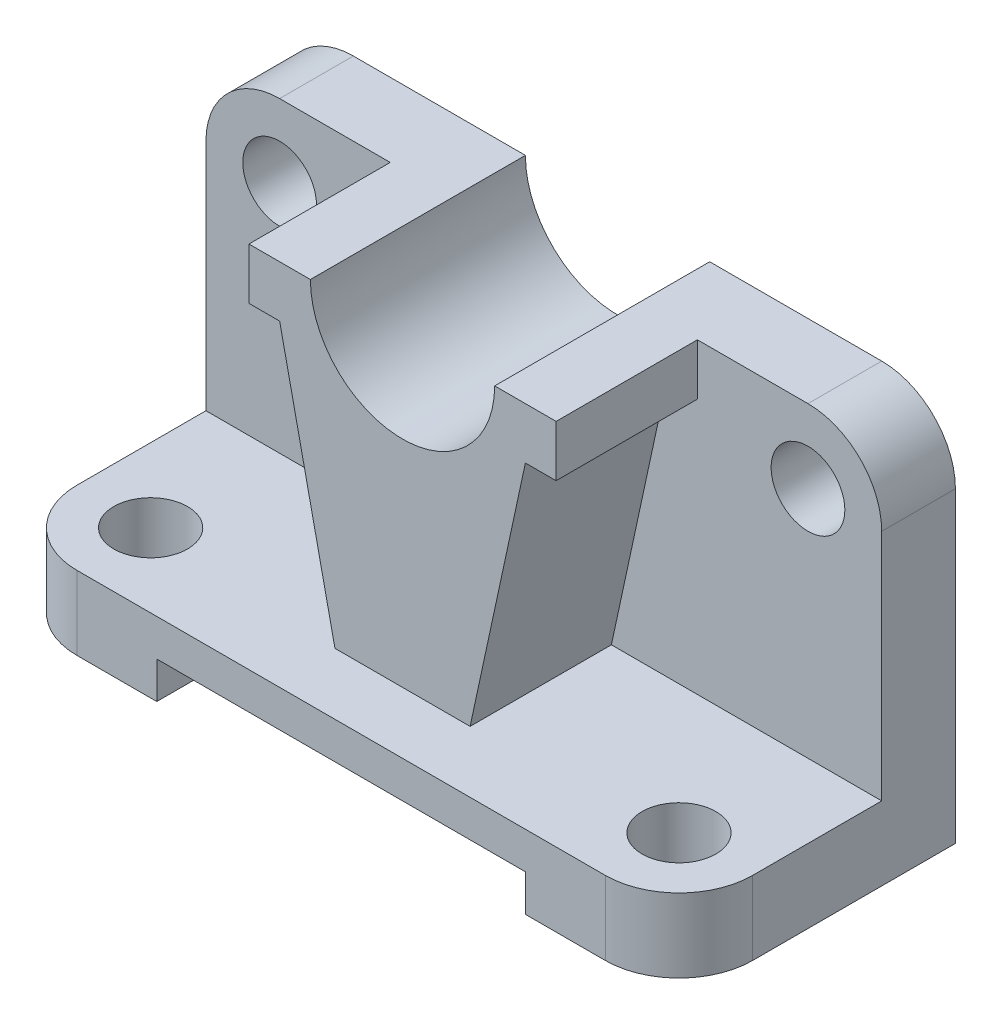
from build123d import *

# Parameters (mm, degrees)
SKETCH1_W           = 110
SKETCH1_H           = 62
BOSS_EXTRUDE1_DEPTH = 12
SKETCH2_W           = 110
SKETCH2_H           = 12
BOSS_EXTRUDE2_DEPTH = 33
BOSS_EXTRUDE3_DEPTH = 23
SKETCH7_R           = 6
CUT_EXTRUDE8_DEPTH  = 131.510535973
SKETCH9_R           = 6
CUT_EXTRUDE9_DEPTH  = 131.510535973
SKETCH10_R          = 6
CUT_EXTRUDE10_DEPTH = 129.937969582
SKETCH11_R          = 6
CUT_EXTRUDE11_DEPTH = 129.937969582
SKETCH15_W          = 60
SKETCH15_H          = 6
CUT_EXTRUDE15_DEPTH = 135.048498686
FILLET3_R           = 12
SKETCH16_R          = 15
CUT_EXTRUDE16_DEPTH = 132.030530793


with BuildPart() as part:
    # Sketch1 → Boss-Extrude1 (new body)
    with BuildSketch(Plane.XY):
        with Locations((55, 31)):
            Rectangle(SKETCH1_W, SKETCH1_H)
    extrude(amount=BOSS_EXTRUDE1_DEPTH)

    # Sketch2 → Boss-Extrude2 (add)
    with BuildSketch(Plane.XY.offset(12)):
        with Locations((55, 6)):
            Rectangle(SKETCH2_W, SKETCH2_H)
    extrude(amount=BOSS_EXTRUDE2_DEPTH)

    # Sketch3 → Boss-Extrude3 (add)
    with BuildSketch(Plane.XY.offset(12)):
        Polygon((75, 53.634363687), (35, 53.634363687), (44, 12), (66, 12), align=None)
        Polygon((80, 62), (30, 62), (30, 53.634363687), (35, 53.634363687), (75, 53.634363687), (80, 53.634363687), align=None)
    extrude(amount=BOSS_EXTRUDE3_DEPTH)

    # Sketch7 → Cut-Extrude8 (cut, through all)
    with BuildSketch(Plane.XY.offset(12)):
        with Locations((12, 50)):
            Circle(SKETCH7_R)
    extrude(amount=-CUT_EXTRUDE8_DEPTH, mode=Mode.SUBTRACT)

    # Sketch9 → Cut-Extrude9 (cut, through all)
    with BuildSketch(Plane.XY.offset(12)):
        with Locations((98, 50)):
            Circle(SKETCH9_R)
    extrude(amount=-CUT_EXTRUDE9_DEPTH, mode=Mode.SUBTRACT)

    # Sketch10 → Cut-Extrude10 (cut, through all)
    with BuildSketch(Plane(origin=(0, 12, 0), x_dir=(1, 0, 0), z_dir=(0, 1, 0))):
        with Locations(Location((12, -33, 0), (0, 0, 270))):
            Circle(SKETCH10_R)
    extrude(amount=-CUT_EXTRUDE10_DEPTH, mode=Mode.SUBTRACT)

    # Sketch11 → Cut-Extrude11 (cut, through all)
    with BuildSketch(Plane(origin=(0, 12, 0), x_dir=(1, 0, 0), z_dir=(0, 1, 0))):
        with Locations(Location((98, -33, 0), (0, 0, 270))):
            Circle(SKETCH11_R)
    extrude(amount=-CUT_EXTRUDE11_DEPTH, mode=Mode.SUBTRACT)

    # Sketch15 → Cut-Extrude15 (cut, through all)
    with BuildSketch(Plane.XY.offset(45)):
        with Locations((55, 3)):
            Rectangle(SKETCH15_W, SKETCH15_H)
    extrude(amount=-CUT_EXTRUDE15_DEPTH, mode=Mode.SUBTRACT)

    # Fillet3
    fillet3_edges = [part.edges().sort_by_distance(p)[0] for p in [
        (0, 6, 45),
        (110, 6, 45),
        (0, 62, 6),
        (110, 62, 6),
    ]]
    fillet(fillet3_edges, radius=FILLET3_R)

    # Sketch16 → Cut-Extrude16 (cut, through all)
    with BuildSketch(Plane.XY.offset(35)):
        with Locations((55, 62)):
            Circle(SKETCH16_R)
    extrude(amount=-CUT_EXTRUDE16_DEPTH, mode=Mode.SUBTRACT)


solid = part.part
